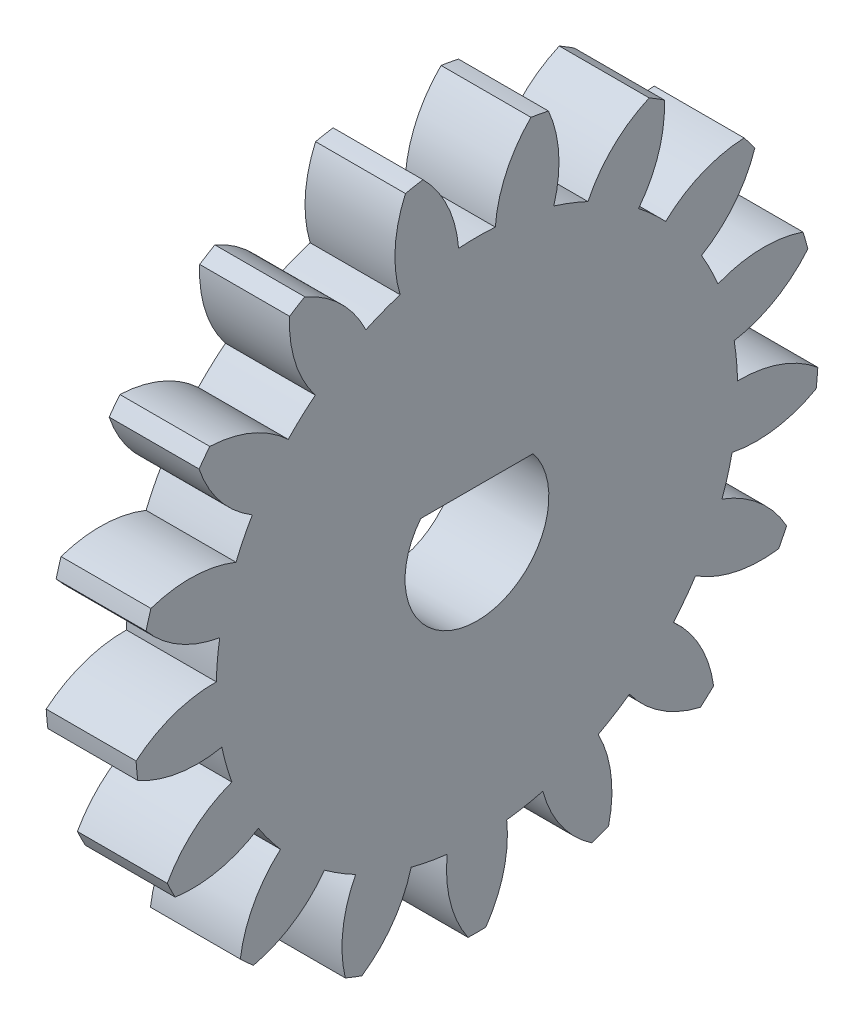
from build123d import *

# Parameters (mm, degrees)
BASPROSKE_W         = 5
BASPROSKE_H         = 19
TOOTHCUT_DEPTH      = 28.331300737
TEETHCUTS_COUNT     = 17
TEETHCUTS_ANGLE     = 338.823529412
BORSKE_R            = 4
BORE_DEPTH          = 50.0000508
BOSS_EXTRUDE1_START = -5
BOSS_EXTRUDE1_DEPTH = 5


with BuildPart() as part:
    # BasProSke → Base-Revolve (revolve)
    with BuildSketch(Plane(origin=(0, 0, 0), x_dir=(1, 0, 0), z_dir=(0, 1, 0)), mode=Mode.PRIVATE) as base_revolve_sk:
        with Locations((2.5, 9.5)):
            Rectangle(BASPROSKE_W, BASPROSKE_H)
    revolve(base_revolve_sk.sketch.rotate(Axis((-10, 0, 0), (1, 0, 0)), 180), axis=Axis((-10, 0, 0), (1, 0, 0)))

    # TooCutSke → ToothCut (cut, through all)
    with BuildSketch(Plane(origin=(0, 0, 0), x_dir=(0, 0, -1), z_dir=(1, 0, 0))):
        with BuildLine():
            ThreePointArc((1.020352389, 14.463052306), (0, 14.499), (-1.020352389, 14.463052306))
            ThreePointArc((-1.020352389, 14.463052306), (-1.632621885, 16.804485203), (-3.026143023, 18.783192049))
            ThreePointArc((-3.026143023, 18.783192049), (0, 19.0254), (3.026143023, 18.783192049))
            ThreePointArc((3.026143023, 18.783192049), (1.632621885, 16.804485203), (1.020352389, 14.463052306))
        make_face()
    toothcut = extrude(amount=TOOTHCUT_DEPTH, mode=Mode.SUBTRACT)

    # TeethCuts: ToothCut ×17 about axis
    teethcuts_axis = Axis((-10, 0, 0), (1, 0, 0))
    for i in range(1, TEETHCUTS_COUNT):
        add(toothcut.rotate(teethcuts_axis, i * TEETHCUTS_ANGLE / (TEETHCUTS_COUNT - 1)), mode=Mode.SUBTRACT)

    # BorSke → Bore (cut, symmetric)
    with BuildSketch(Plane(origin=(0, 0, 0), x_dir=(0, 0, -1), z_dir=(1, 0, 0))):
        with Locations(Location((0, 0, 0), (0, 0, 180))):
            Circle(BORSKE_R)
    extrude(amount=BORE_DEPTH, both=True, mode=Mode.SUBTRACT)

    # Sketch1 → Boss-Extrude1 (add)
    with BuildSketch(Plane.ZY.offset(BOSS_EXTRUDE1_START)):
        with BuildLine():
            ThreePointArc((3.122498999, 2.5), (0, 4), (-3.122498999, 2.5))
            Line((-3.122498999, 2.5), (3.122498999, 2.5))
        make_face()
    extrude(amount=BOSS_EXTRUDE1_DEPTH)


solid = part.part
